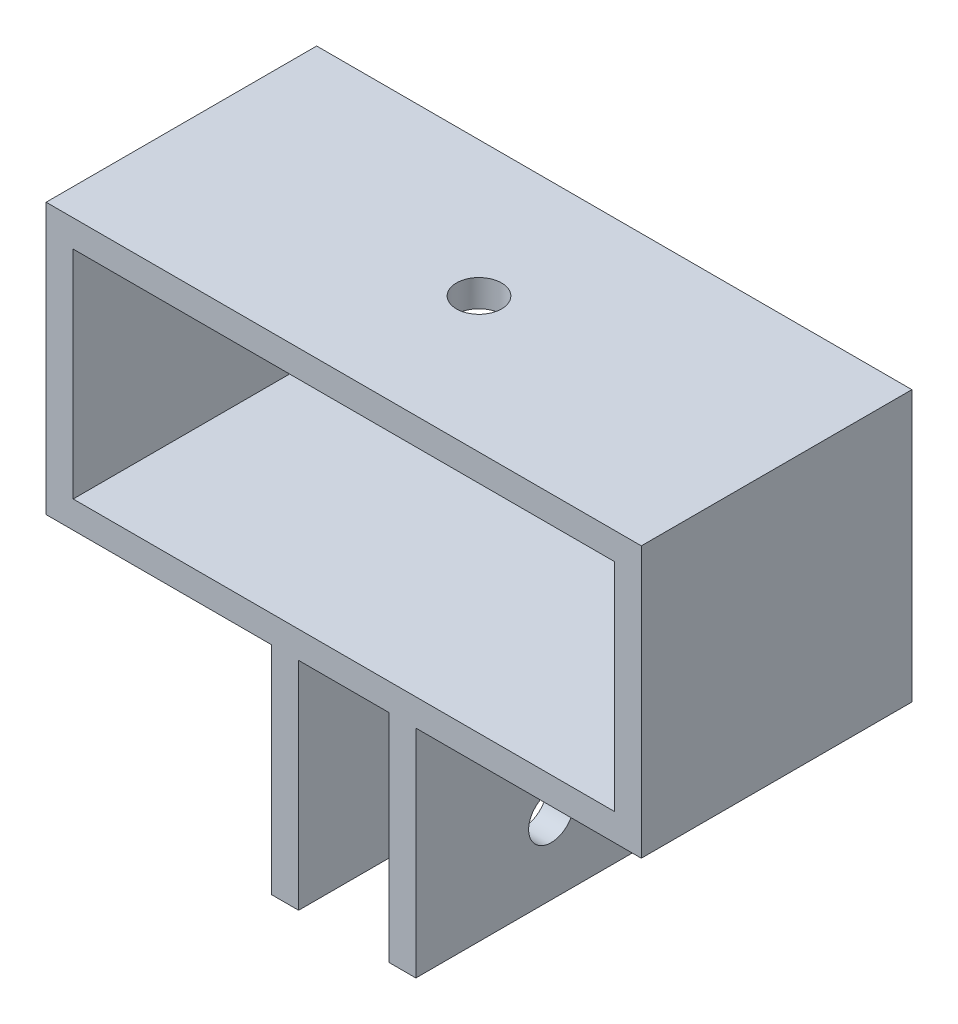
from build123d import *

# Parameters (mm, degrees)
SKETCH1_W           = 66
SKETCH1_H           = 30
BOSS_EXTRUDE1_DEPTH = 30
SKETCH2_W           = 30
SKETCH2_H           = 24
CUT_EXTRUDE1_DEPTH  = 54.749418602
SKETCH3_R           = 2.5
CUT_EXTRUDE2_DEPTH  = 10
SKETCH4_W           = 16
SKETCH4_H           = 30
BOSS_EXTRUDE2_DEPTH = 24
SKETCH5_W           = 10
SKETCH5_H           = 24
CUT_EXTRUDE3_DEPTH  = 54.749418602
SKETCH6_R           = 2.5
CUT_EXTRUDE4_DEPTH  = 24


with BuildPart() as part:
    # Sketch1 → Boss-Extrude1 (new body)
    with BuildSketch(Plane(origin=(0, 0, 0), x_dir=(1, 0, 0), z_dir=(0, 1, 0))):
        Rectangle(SKETCH1_W, SKETCH1_H)
    extrude(amount=BOSS_EXTRUDE1_DEPTH)

    # Sketch2 → Cut-Extrude1 (cut, through all)
    with BuildSketch(Plane.XY.offset(15)):
        with Locations((15, 15)):
            Rectangle(SKETCH2_W, SKETCH2_H)
        with Locations((-15, 15)):
            Rectangle(SKETCH2_W, SKETCH2_H)
    extrude(amount=-CUT_EXTRUDE1_DEPTH, mode=Mode.SUBTRACT)

    # Sketch3 → Cut-Extrude2 (cut)
    with BuildSketch(Plane(origin=(0, 30, 0), x_dir=(1, 0, 0), z_dir=(0, 1, 0))):
        with Locations(Location((0, 0, 0), (0, 0, 270))):
            Circle(SKETCH3_R)
    extrude(amount=-CUT_EXTRUDE2_DEPTH, mode=Mode.SUBTRACT)

    # Sketch4 → Boss-Extrude2 (add)
    with BuildSketch(Plane.XZ):
        Rectangle(SKETCH4_W, SKETCH4_H)
    extrude(amount=BOSS_EXTRUDE2_DEPTH)

    # Sketch5 → Cut-Extrude3 (cut, through all)
    with BuildSketch(Plane.XY.offset(15)):
        with Locations((0, -12)):
            Rectangle(SKETCH5_W, SKETCH5_H)
    extrude(amount=-CUT_EXTRUDE3_DEPTH, mode=Mode.SUBTRACT)

    # Sketch6 → Cut-Extrude4 (cut)
    with BuildSketch(Plane(origin=(8, 0, 0), x_dir=(0, 0, -1), z_dir=(1, 0, 0))):
        with Locations((0, -16)):
            Circle(SKETCH6_R)
    extrude(amount=-CUT_EXTRUDE4_DEPTH, mode=Mode.SUBTRACT)


solid = part.part
